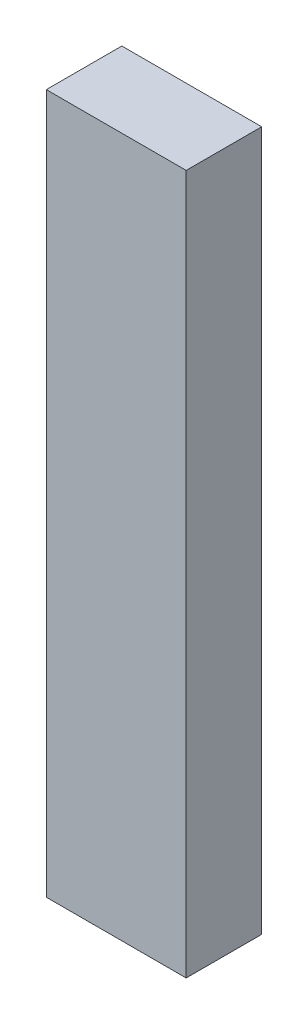
from build123d import *

# Parameters (mm, degrees)
SKETCH1_W           = 100
SKETCH1_H           = 54
BOSS_EXTRUDE1_DEPTH = 500


with BuildPart() as part:
    # Sketch1 → Boss-Extrude1 (new body)
    with BuildSketch(Plane(origin=(0, 0, 0), x_dir=(1, 0, 0), z_dir=(0, 1, 0))):
        Rectangle(SKETCH1_W, SKETCH1_H)
    extrude(amount=BOSS_EXTRUDE1_DEPTH)


solid = part.part
